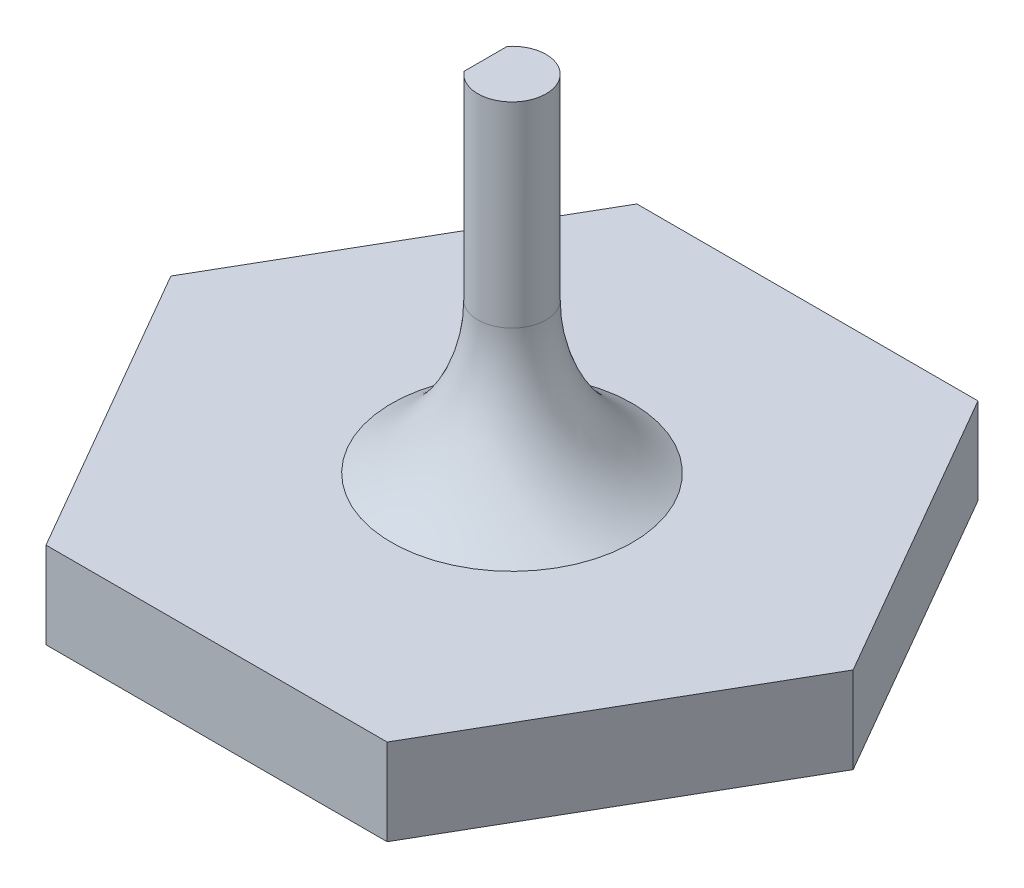
from build123d import *

# Parameters (mm, degrees)
BOSS_EXTRUDE1_DEPTH = 10
CUT_EXTRUDE1_START  = -10
CUT_EXTRUDE1_DEPTH  = 10


with BuildPart() as part:
    # Sketch1 → Boss-Extrude1 (new body)
    with BuildSketch(Plane(origin=(0, 0, 0), x_dir=(1, 0, 0), z_dir=(0, 1, 0))):
        Polygon((-19.75, 34.208003449), (-39.5, 0), (-19.75, -34.208003449), (19.75, -34.208003449), (39.5, 0), (19.75, 34.208003449), align=None)
    extrude(amount=BOSS_EXTRUDE1_DEPTH)

    # Sketch7 → Revolve1 (revolve)
    with BuildSketch(Plane(origin=(0, 0, 0), x_dir=(0, 0, -1), z_dir=(1, 0, 0))):
        with BuildLine():
            Line((0, 10), (0, 50))
            Line((0, 50), (3.95, 50))
            Line((3.95, 50), (3.95, 27.320508076))
            ThreePointArc((3.95, 27.320508076), (6.629491924, 17.320508076), (13.95, 10))
            Line((13.95, 10), (0, 10))
        make_face()
    revolve(axis=Axis((0, 10, 0), (0, 1, 0)))

    # Sketch8 → Cut-Extrude1 (cut)
    with BuildSketch(Plane(origin=(0, 50, 0), x_dir=(1, 0, 0), z_dir=(0, 1, 0)).offset(CUT_EXTRUDE1_START)):
        with BuildLine():
            Line((-3.058185737, -2.5), (-3.058185737, 2.5))
            ThreePointArc((-3.058185737, 2.5), (-3.95, 0), (-3.058185737, -2.5))
        make_face()
    extrude(amount=CUT_EXTRUDE1_DEPTH, mode=Mode.SUBTRACT)


solid = part.part
